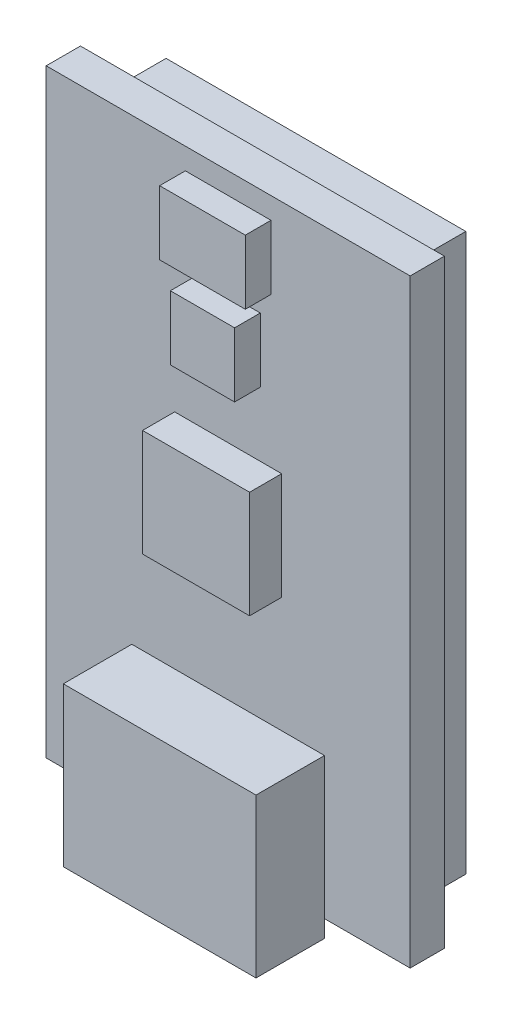
from build123d import *

# Parameters (mm, degrees)
SKETCH1_W           = 14
SKETCH1_H           = 26
BOSS_EXTRUDE1_DEPTH = 2.5
SKETCH2_W           = 17
SKETCH2_H           = 28
BOSS_EXTRUDE2_DEPTH = 1.6
SKETCH3_W           = 9
SKETCH3_H           = 7.4
BOSS_EXTRUDE3_DEPTH = 3.2
SKETCH4_W           = 5
SKETCH4_H           = 5
BOSS_EXTRUDE4_DEPTH = 1.5
SKETCH5_W           = 3
SKETCH5_H           = 3
BOSS_EXTRUDE5_DEPTH = 1.2
SKETCH6_W           = 4
SKETCH6_H           = 3
BOSS_EXTRUDE6_DEPTH = 1.2


with BuildPart() as part:
    # Sketch1 → Boss-Extrude1 (new body)
    with BuildSketch(Plane.XY.offset(10.6)):
        with Locations((18, 36)):
            Rectangle(SKETCH1_W, SKETCH1_H)
    extrude(amount=BOSS_EXTRUDE1_DEPTH)

    # Sketch2 → Boss-Extrude2 (add)
    with BuildSketch(Plane.XY.offset(13.1)):
        with Locations((18, 36)):
            Rectangle(SKETCH2_W, SKETCH2_H)
    extrude(amount=BOSS_EXTRUDE2_DEPTH)

    # Sketch3 → Boss-Extrude3 (add)
    with BuildSketch(Plane.XY.offset(14.7)):
        with Locations((18, 24.9)):
            Rectangle(SKETCH3_W, SKETCH3_H)
    extrude(amount=BOSS_EXTRUDE3_DEPTH)

    # Sketch4 → Boss-Extrude4 (add)
    with BuildSketch(Plane.XY.offset(14.7)):
        with Locations((18, 36.5)):
            Rectangle(SKETCH4_W, SKETCH4_H)
    extrude(amount=BOSS_EXTRUDE4_DEPTH)

    # Sketch5 → Boss-Extrude5 (add)
    with BuildSketch(Plane.XY.offset(14.7)):
        with Locations((18, 43.5)):
            Rectangle(SKETCH5_W, SKETCH5_H)
    extrude(amount=BOSS_EXTRUDE5_DEPTH)

    # Sketch6 → Boss-Extrude6 (add)
    with BuildSketch(Plane.XY.offset(14.7)):
        with Locations((18, 47.5)):
            Rectangle(SKETCH6_W, SKETCH6_H)
    extrude(amount=BOSS_EXTRUDE6_DEPTH)


solid = part.part
